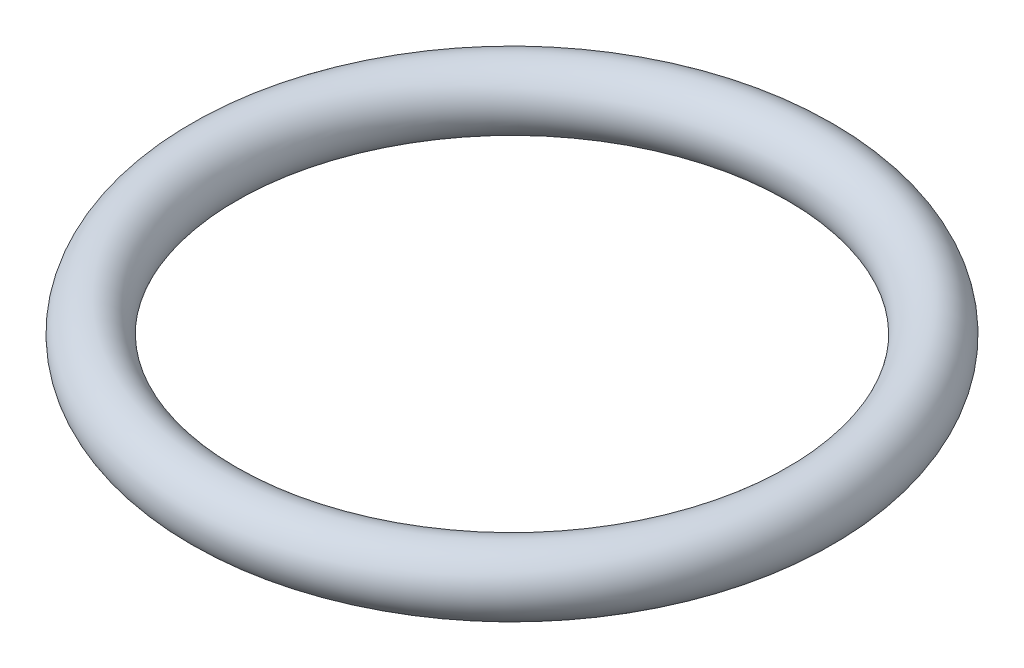
from build123d import *

# Parameters (mm, degrees)
SKETCH_1_R = 0.7


with BuildPart() as part:
    # Эскиз1 → Повернуть1 (revolve)
    with BuildSketch(Plane.XY, mode=Mode.PRIVATE) as revolve_1_sk:
        with Locations((-6.6, 0)):
            Circle(SKETCH_1_R)
    revolve(revolve_1_sk.sketch.rotate(Axis((0, 0.825, 0), (0, -1, 0)), 270), axis=Axis((0, 0.825, 0), (0, -1, 0)))


solid = part.part
